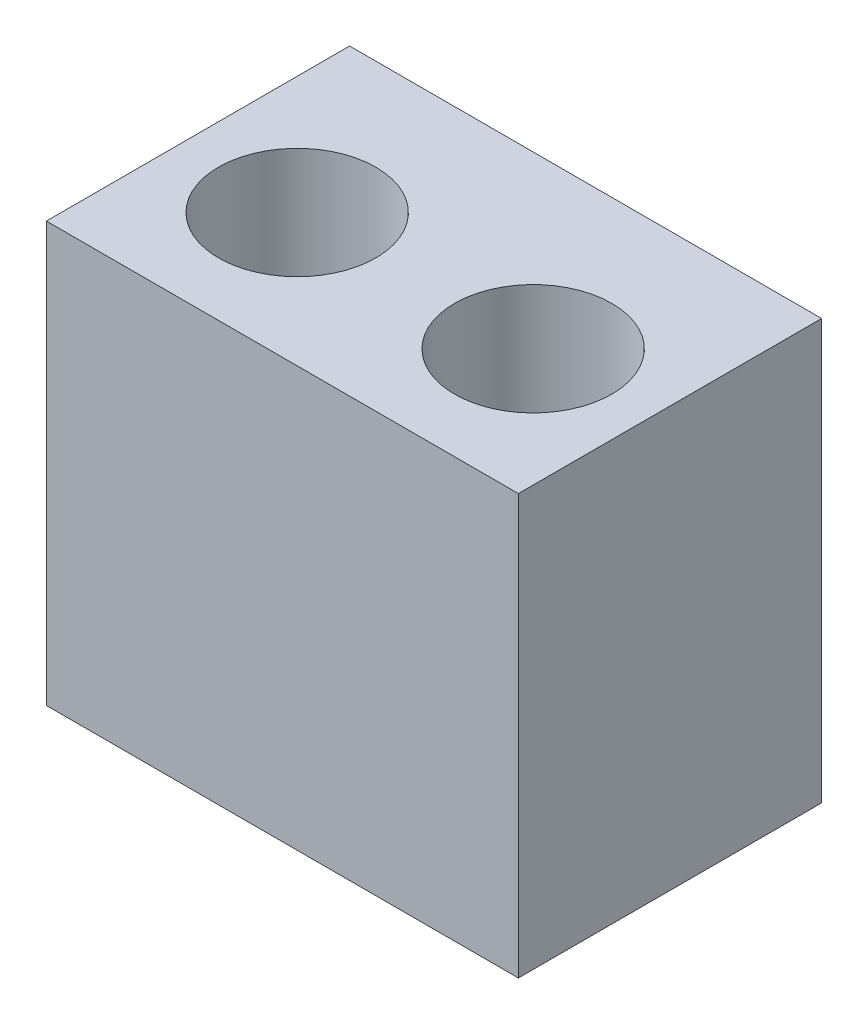
from build123d import *

# Parameters (mm, degrees)
SKETCH1_W           = 45
SKETCH1_H           = 40
BOSS_EXTRUDE1_DEPTH = 28.91
SKETCH2_R           = 7.5
CUT_EXTRUDE1_DEPTH  = 189.461126468


with BuildPart() as part:
    # Sketch1 → Boss-Extrude1 (new body)
    with BuildSketch(Plane.XY):
        with Locations((159.384051224, 33.588569403)):
            Rectangle(SKETCH1_W, SKETCH1_H)
    extrude(amount=BOSS_EXTRUDE1_DEPTH)

    # Sketch2 → Cut-Extrude1 (cut, through all)
    with BuildSketch(Plane.XZ.offset(-13.588569403)):
        with Locations(Location((148.134051224, 16.25, 0), (0, 0, 270))):
            Circle(SKETCH2_R)
        with Locations(Location((170.634051224, 16.25, 0), (0, 0, 270))):
            Circle(SKETCH2_R)
    extrude(amount=-CUT_EXTRUDE1_DEPTH, mode=Mode.SUBTRACT)


solid = part.part
